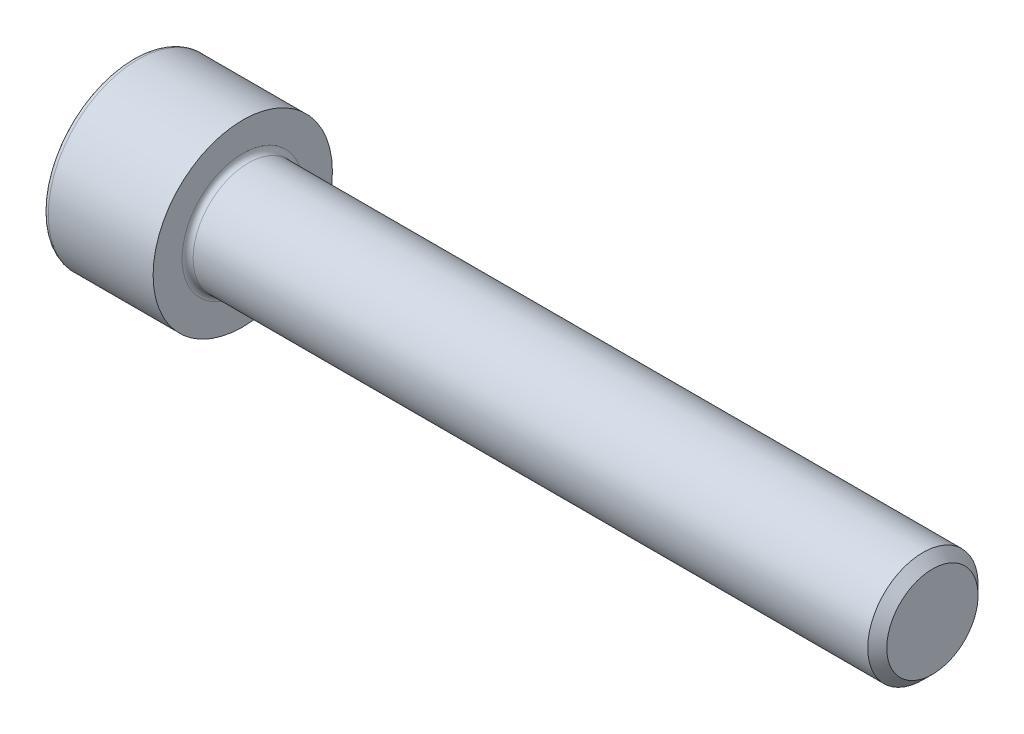
from build123d import *

# Parameters (mm, degrees)
FILLET1_R   = 0.4
FILLET2_R   = 0.4
HEX_2_DEPTH = 4


with BuildPart() as part:
    # BodySke → Base-Revolve (revolve)
    with BuildSketch(Plane.XY, mode=Mode.PRIVATE) as base_revolve_sk:
        Polygon((0, 0), (0, 6.5), (8, 6.5), (8, 4), (57.3095, 4), (58, 3.3095), (58, 0), align=None)
    revolve(base_revolve_sk.sketch.rotate(Axis((-31.75, 0, 0), (1, 0, 0)), 90), axis=Axis((-31.75, 0, 0), (1, 0, 0)))

    # Fillet1
    fillet1_edges = [part.edges().sort_by_distance(p)[0] for p in [
        (8, 0, -4),
    ]]
    fillet(fillet1_edges, radius=FILLET1_R)

    # Fillet2
    fillet2_edges = [part.edges().sort_by_distance(p)[0] for p in [
        (0, 0, -6.5),
    ]]
    fillet(fillet2_edges, radius=FILLET2_R)

    # Sketch2 → Hex-PreBroach (revolve, cut)
    with BuildSketch(Plane.XY, mode=Mode.PRIVATE) as hex_prebroach_sk:
        Polygon((0, 3.0475), (4, 3.0475), (5.759474945, 0), (0, 0), align=None)
    revolve(hex_prebroach_sk.sketch.rotate(Axis((0, 0, 0), (1, 0, 0)), 90), axis=Axis((0, 0, 0), (1, 0, 0)), mode=Mode.SUBTRACT)

    # Sketch3 → Hex 2 (cut)
    with BuildSketch(Plane(origin=(0, 0, 0), x_dir=(0, 0.500000000000001, 0.866025403784438), z_dir=(-1, 0, 0))):
        Polygon((1.759474945, 3.0475), (-1.759474945, 3.0475), (-3.518949891, 0), (-1.759474945, -3.0475), (1.759474945, -3.0475), (3.518949891, 0), align=None)
    extrude(amount=-HEX_2_DEPTH, mode=Mode.SUBTRACT)


solid = part.part
